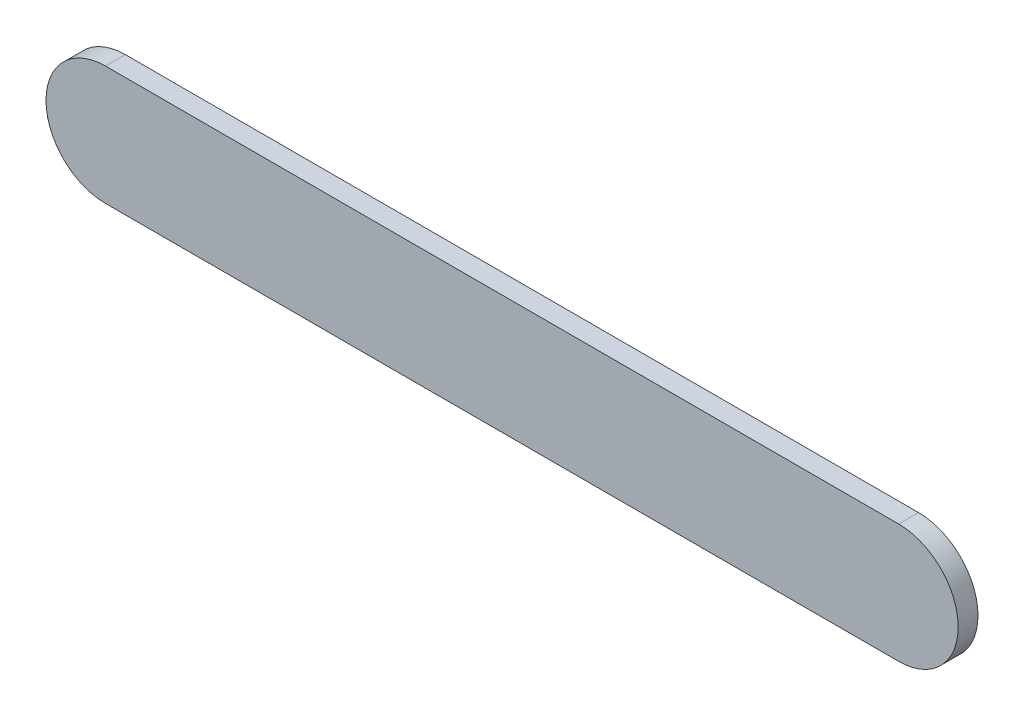
from build123d import *

# Parameters (mm, degrees)
EXTRUDE_1_DEPTH = 10


with BuildPart() as part:
    # 草图1 → 凸台-拉伸1 (new body)
    with BuildSketch(Plane.XY):
        with BuildLine():
            Line((400, 30), (0, 30))
            ThreePointArc((0, 30), (-30, 0), (0, -30))
            Line((0, -30), (400, -30))
            ThreePointArc((400, -30), (430, 0), (400, 30))
        make_face()
    extrude(amount=EXTRUDE_1_DEPTH)


solid = part.part
